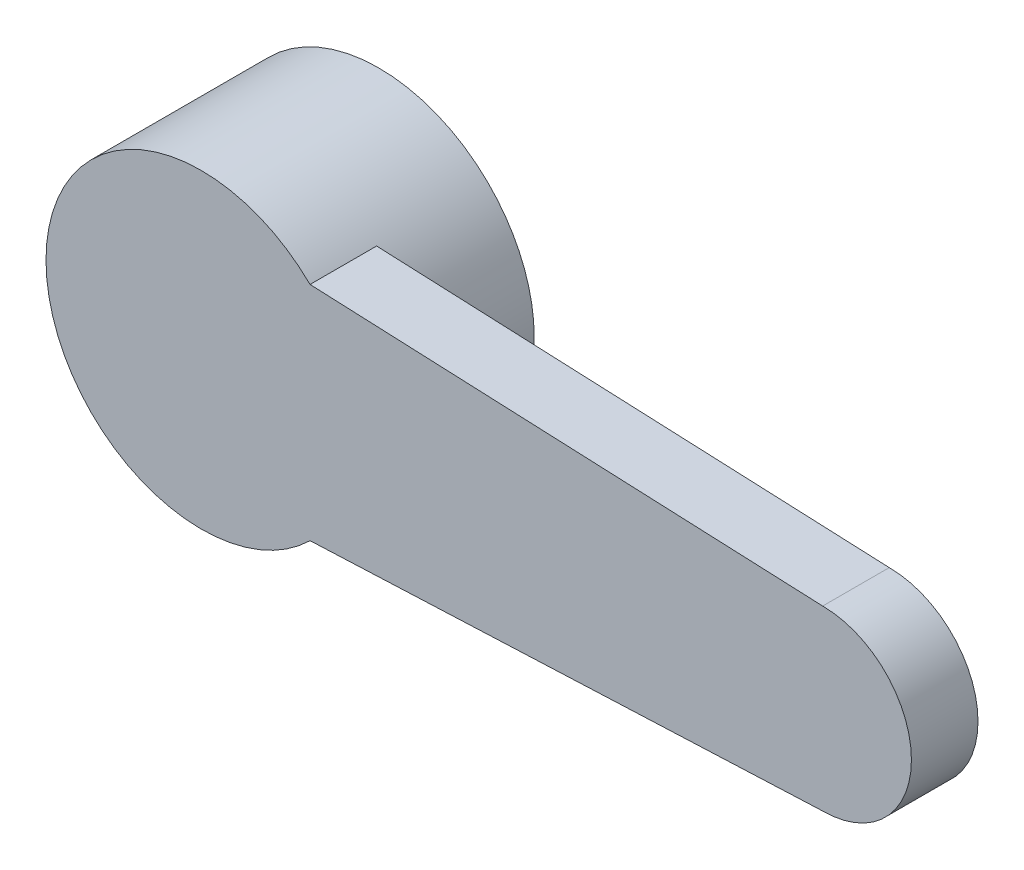
from build123d import *

# Parameters (mm, degrees)
SKETCH_1_R      = 3.5
EXTRUDE_1_DEPTH = 4
EXTRUDE_2_DEPTH = 1.5


with BuildPart() as part:
    # 草图1 → 凸台-拉伸1 (new body)
    with BuildSketch(Plane.XY):
        Circle(SKETCH_1_R)
    extrude(amount=EXTRUDE_1_DEPTH)

    # 草图2 → 凸台-拉伸2 (add)
    with BuildSketch(Plane.XY.offset(4)):
        with BuildLine():
            Line((2.449489743, 2.5), (14, 2))
            ThreePointArc((14, 2), (16, 0), (14, -2))
            Line((14, -2), (2.449489743, -2.5))
            Line((2.449489743, -2.5), (2.449489743, 2.5))
        make_face()
    extrude(amount=-EXTRUDE_2_DEPTH)


solid = part.part
